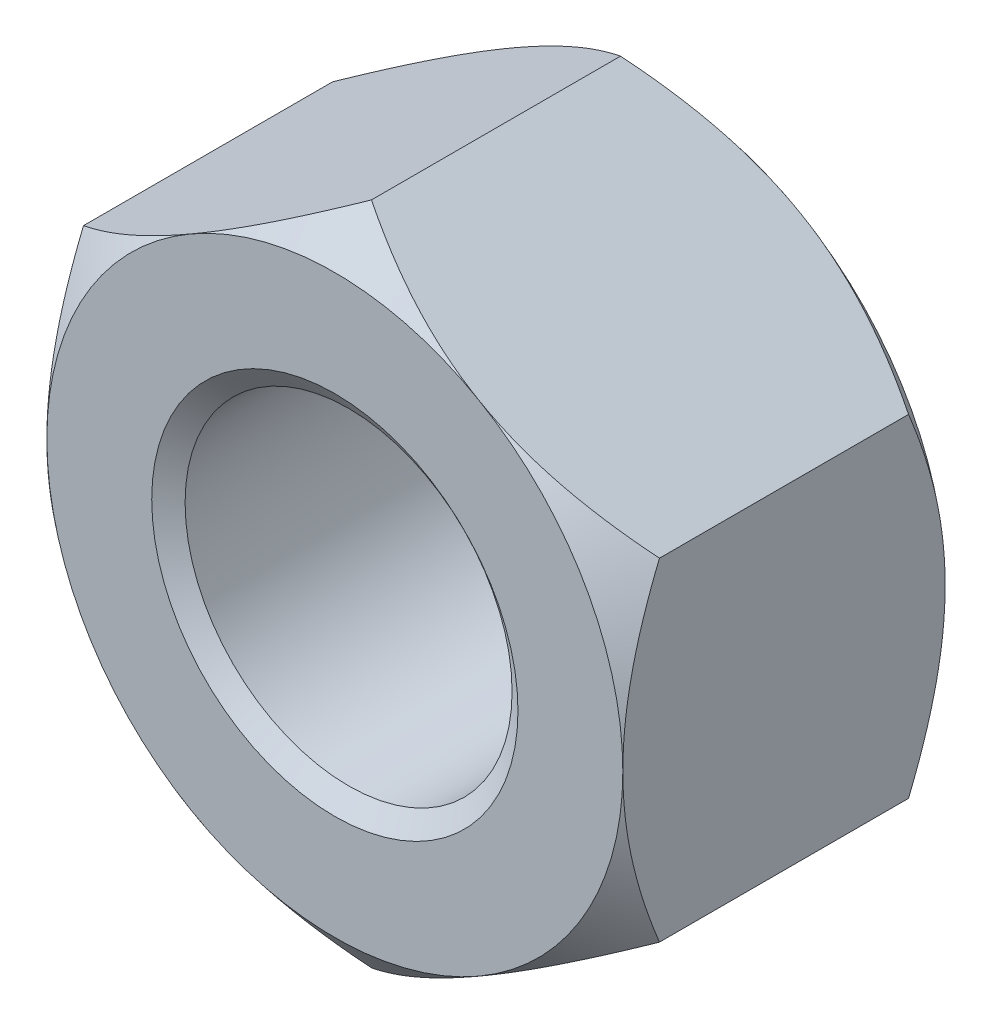
from build123d import *

# Parameters (mm, degrees)
BASENUTSKE_R  = 4.96062
BASENUT_DEPTH = 9.779


with BuildPart() as part:
    # BaseNutSke → BaseNut (new body)
    with BuildSketch(Plane.XY):
        Polygon((8.7376, 5.044655712), (8.7376, -5.044655712), (0, -10.089311424), (-8.7376, -5.044655712), (-8.7376, 5.044655712), (0, 10.089311424), align=None)
        Circle(BASENUTSKE_R, mode=Mode.SUBTRACT)
    extrude(amount=-BASENUT_DEPTH)

    # Sketch3 → Double-Chamfer (revolve, cut)
    with BuildSketch(Plane(origin=(0, 0, 0), x_dir=(0, 0, -1), z_dir=(1, 0, 0))):
        Polygon((9.779, 8.7376), (8.66775, 10.089311424), (8.66775, 22.789311424), (22.479, 22.789311424), (22.479, 8.7376), align=None)
        Polygon((1.11125, 22.789311424), (-12.7, 22.789311424), (-12.7, 8.7376), (0, 8.7376), (1.11125, 10.089311424), align=None)
    revolve(axis=Axis((0, 0, 0), (0, 0, -1)), mode=Mode.SUBTRACT)

    # Sketch5 → EndChamfer (revolve, cut)
    with BuildSketch(Plane(origin=(0, 0, 0), x_dir=(0, 0, -1), z_dir=(1, 0, 0)), mode=Mode.PRIVATE) as endchamfer_sk:
        Polygon((9.7536, 5.55625), (9.294828922, 4.901057), (9.8044, 4.901057), (9.8044, 5.55625), align=None)
        Polygon((-0.0508, 5.55625), (0, 5.55625), (0.458771078, 4.901057), (-0.0508, 4.901057), align=None)
    revolve(endchamfer_sk.sketch.rotate(Axis((0, 0, -25.037505729), (0, 0, -1)), 90), axis=Axis((0, 0, -25.037505729), (0, 0, -1)), mode=Mode.SUBTRACT)


solid = part.part
